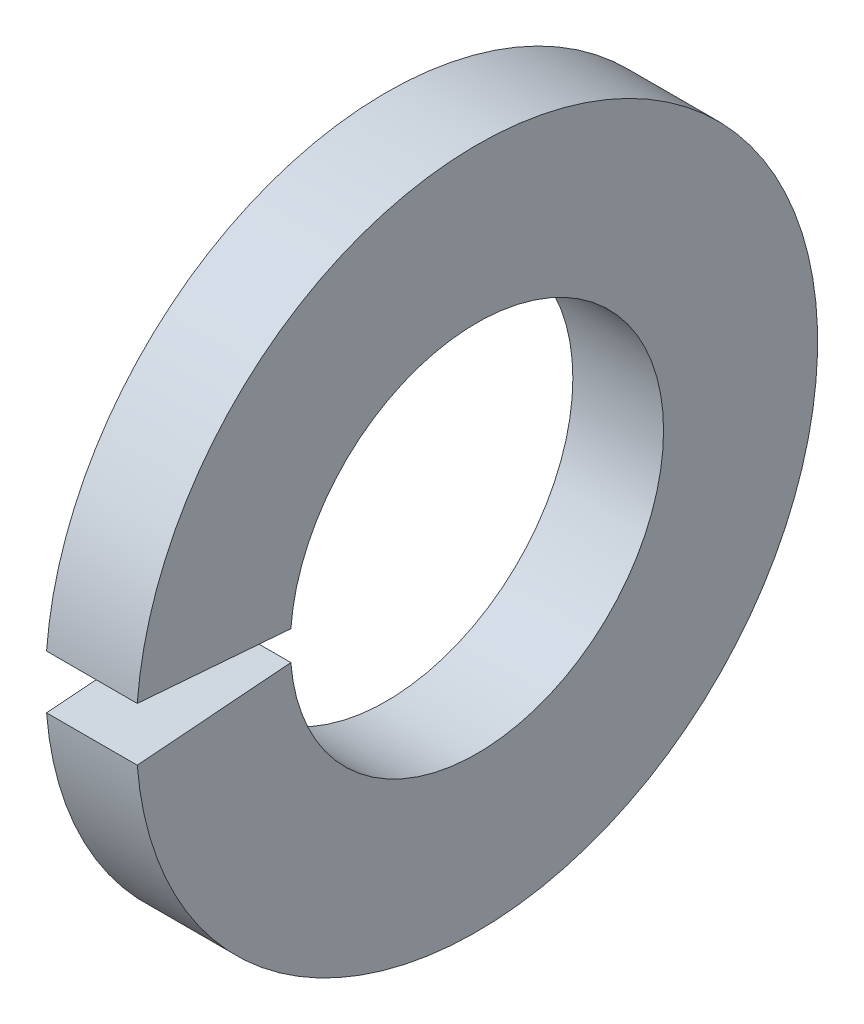
from build123d import *

# Parameters (mm, degrees)
SKETCH1_W      = 1.9812
SKETCH1_H      = 3.3655
REVOLVE1_ANGLE = 351


with BuildPart() as part:
    # Sketch1 → Revolve1 (revolve)
    with BuildSketch(Plane(origin=(0, 0, 0), x_dir=(-1, 0, 0), z_dir=(0, 0.996917333733128, 0.07845909572784562))):
        with Locations((0.9906, 5.75945)):
            Rectangle(SKETCH1_W, SKETCH1_H)
    revolve(axis=Axis((0, 0, 0), (1, 0, 0)), revolution_arc=REVOLVE1_ANGLE)


solid = part.part
